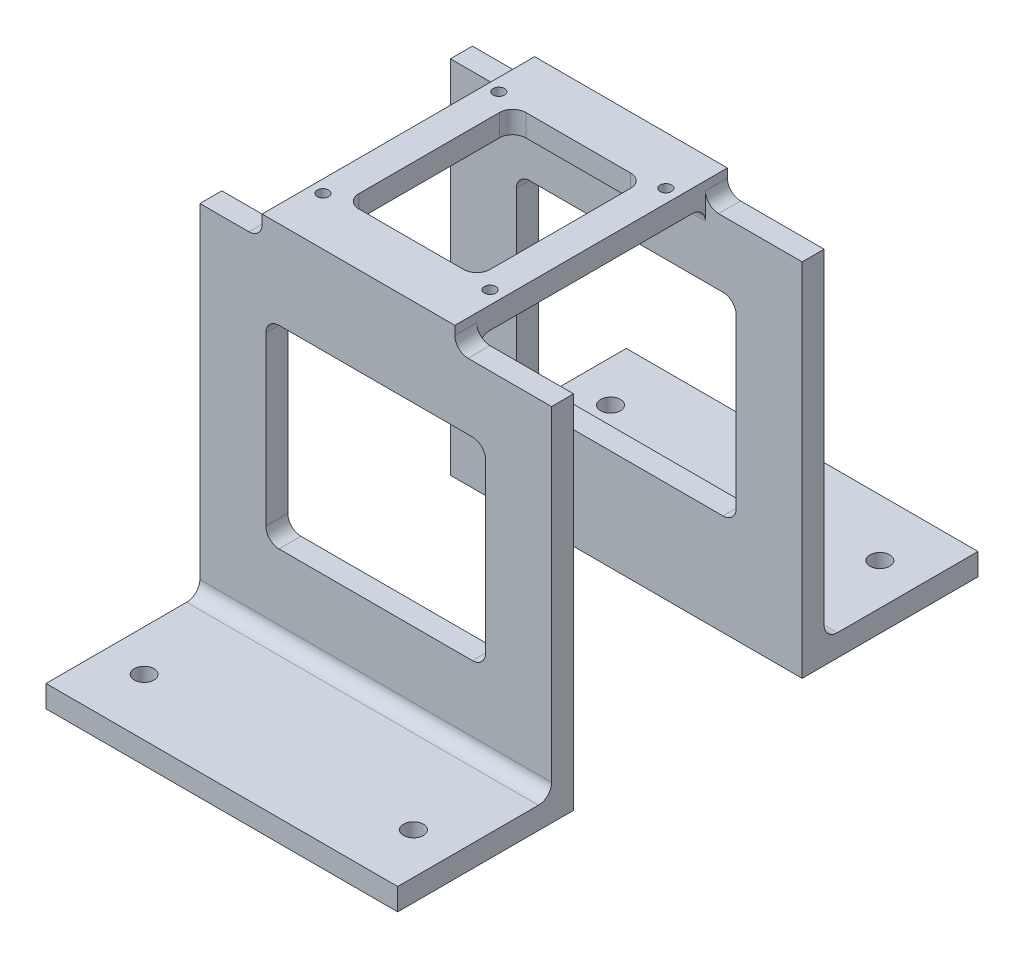
from build123d import *

# Parameters (mm, degrees)
SKETCH1_W               = 80
SKETCH1_H               = 40
SKETCH1_R               = 2.25
BOSS_EXTRUDE1_DEPTH     = 5
BOSS_EXTRUDE1_2_DEPTH   = 5
SKETCH2_W               = 80
SKETCH2_H               = 5
BOSS_EXTRUDE2_DEPTH     = 77.05
SKETCH3_W               = 43.85
SKETCH3_H               = 62
BOSS_EXTRUDE3_DEPTH     = 5
SKETCH5_W               = 29.85
SKETCH5_H               = 38
CUT_EXTRUDE2_DEPTH      = 10
CUT_EXTRUDE1_REACH      = 118.334
SKETCH4_R               = 1.3
FILLET1_R               = 3
FILLET2_R               = 3
CUT_EXTRUDE3_DEPTH      = 137.333057253
CUT_EXTRUDE3_DEPTH_BACK = 137.333057253
SKETCH6_W               = 50
SKETCH6_H               = 44.05
FILLET3_R               = 3


with BuildPart() as part:
    # Sketch1 → Boss-Extrude1 (new body)
    with BuildSketch(Plane(origin=(0, 0, 0), x_dir=(1, 0, 0), z_dir=(0, 1, 0))):
        with Locations((0, 46)):
            Rectangle(SKETCH1_W, SKETCH1_H)
        with Locations(Location((-30.625, 53.044055982, 0), (0, 0, 270))):
            Circle(SKETCH1_R, mode=Mode.SUBTRACT)
        with Locations(Location((30.625, 53.044055982, 0), (0, 0, 90))):
            Circle(SKETCH1_R, mode=Mode.SUBTRACT)
    extrude(amount=BOSS_EXTRUDE1_DEPTH)



with BuildPart() as body_2:
    # Sketch1 → Boss-Extrude1 2 (new body)
    with BuildSketch(Plane(origin=(0, 0, 0), x_dir=(1, 0, 0), z_dir=(0, 1, 0))):
        with Locations((0, -46)):
            Rectangle(SKETCH1_W, SKETCH1_H)
        with Locations(Location((30.625, -53.044055982, 0), (0, 0, 270))):
            Circle(SKETCH1_R, mode=Mode.SUBTRACT)
        with Locations(Location((-30.625, -53.044055982, 0), (0, 0, 90))):
            Circle(SKETCH1_R, mode=Mode.SUBTRACT)
    extrude(amount=BOSS_EXTRUDE1_2_DEPTH)


with BuildPart() as part_1:
    add(part.part)

    add(body_2.part)  # Boss-Extrude2 merges body 2
    # Sketch2 → Boss-Extrude2 (add)
    with BuildSketch(Plane(origin=(0, 5, 0), x_dir=(1, 0, 0), z_dir=(0, 1, 0))):
        with Locations((0, 28.5)):
            Rectangle(SKETCH2_W, SKETCH2_H)
        with Locations((0, -28.5)):
            Rectangle(SKETCH2_W, SKETCH2_H)
    extrude(amount=BOSS_EXTRUDE2_DEPTH)

    # Sketch3 → Boss-Extrude3 (add)
    with BuildSketch(Plane(origin=(0, 82.05, 0), x_dir=(1, 0, 0), z_dir=(0, 1, 0))):
        with Locations((-3.925, 0)):
            Rectangle(SKETCH3_W, SKETCH3_H)
    extrude(amount=BOSS_EXTRUDE3_DEPTH)

    # Sketch5 → Cut-Extrude2 (cut)
    with BuildSketch(Plane.XZ.offset(-82.05)):
        with Locations((-3.925, 0)):
            Rectangle(SKETCH5_W, SKETCH5_H)
    extrude(amount=-CUT_EXTRUDE2_DEPTH, mode=Mode.SUBTRACT)

    # Sketch4 → Cut-Extrude1 (cut, up to next)
    with BuildSketch(Plane(origin=(0, 87.05, 0), x_dir=(1, 0, 0), z_dir=(0, 1, 0)), mode=Mode.PRIVATE) as cut_extrude1_sk1:
        with Locations(Location((-23, 20, 0), (0, 0, 270))):
            Circle(SKETCH4_R)
    cut_extrude1_tool1 = extrude(cut_extrude1_sk1.sketch, amount=-CUT_EXTRUDE1_REACH, mode=Mode.PRIVATE) & part_1.part
    # Sketch4 → Cut-Extrude1 (cut, up to next)
    with BuildSketch(Plane(origin=(0, 87.05, 0), x_dir=(1, 0, 0), z_dir=(0, 1, 0)), mode=Mode.PRIVATE) as cut_extrude1_sk2:
        with Locations(Location((15, 20, 0), (0, 0, 270))):
            Circle(SKETCH4_R)
    cut_extrude1_tool2 = extrude(cut_extrude1_sk2.sketch, amount=-CUT_EXTRUDE1_REACH, mode=Mode.PRIVATE) & part_1.part
    # Sketch4 → Cut-Extrude1 (cut, up to next)
    with BuildSketch(Plane(origin=(0, 87.05, 0), x_dir=(1, 0, 0), z_dir=(0, 1, 0)), mode=Mode.PRIVATE) as cut_extrude1_sk3:
        with Locations(Location((15, -20, 0), (0, 0, 270))):
            Circle(SKETCH4_R)
    cut_extrude1_tool3 = extrude(cut_extrude1_sk3.sketch, amount=-CUT_EXTRUDE1_REACH, mode=Mode.PRIVATE) & part_1.part
    # Sketch4 → Cut-Extrude1 (cut, up to next)
    with BuildSketch(Plane(origin=(0, 87.05, 0), x_dir=(1, 0, 0), z_dir=(0, 1, 0)), mode=Mode.PRIVATE) as cut_extrude1_sk4:
        with Locations(Location((-23, -20, 0), (0, 0, 270))):
            Circle(SKETCH4_R)
    cut_extrude1_tool4 = extrude(cut_extrude1_sk4.sketch, amount=-CUT_EXTRUDE1_REACH, mode=Mode.PRIVATE) & part_1.part
    add(cut_extrude1_tool1.solids().sort_by_distance((-23, 87.05, -20))[0], mode=Mode.SUBTRACT)
    add(cut_extrude1_tool2.solids().sort_by_distance((15, 87.05, -20))[0], mode=Mode.SUBTRACT)
    add(cut_extrude1_tool3.solids().sort_by_distance((15, 87.05, 20))[0], mode=Mode.SUBTRACT)
    add(cut_extrude1_tool4.solids().sort_by_distance((-23, 87.05, 20))[0], mode=Mode.SUBTRACT)

    # Fillet1
    fillet1_edges = [part_1.edges().sort_by_distance(p)[0] for p in [
        (0, 5, -31),
        (-3.925, 82.05, -26),
        (-3.925, 82.05, 26),
        (0, 5, 31),
    ]]
    fillet(fillet1_edges, radius=FILLET1_R)

    # Fillet2
    fillet2_edges = [part_1.edges().sort_by_distance(p)[0] for p in [
        (18, 82.05, -28.5),
        (-25.85, 82.05, -28.5),
        (-25.85, 82.05, 28.5),
        (18, 82.05, 28.5),
    ]]
    fillet(fillet2_edges, radius=FILLET2_R)

    # Sketch6 → Cut-Extrude3 (cut, two sides: drawn at the far end of the back side and taken through both)
    with BuildSketch(Plane.XY.offset(31).offset(-CUT_EXTRUDE3_DEPTH_BACK)):
        with Locations((0, 45.025)):
            Rectangle(SKETCH6_W, SKETCH6_H)
    extrude(amount=CUT_EXTRUDE3_DEPTH + CUT_EXTRUDE3_DEPTH_BACK, mode=Mode.SUBTRACT)

    # Fillet3
    fillet3_edges = [part_1.edges().sort_by_distance(p)[0] for p in [
        (-25, 67.05, -28.5),
        (-25, 67.05, 28.5),
        (-25, 23, -28.5),
        (-25, 23, 28.5),
        (25, 23, -28.5),
        (25, 23, 28.5),
        (25, 67.05, -28.5),
        (25, 67.05, 28.5),
        (-18.85, 84.55, -19),
        (-18.85, 84.55, 19),
        (11, 84.55, 19),
        (11, 84.55, -19),
    ]]
    fillet(fillet3_edges, radius=FILLET3_R)


solid = part_1.part
